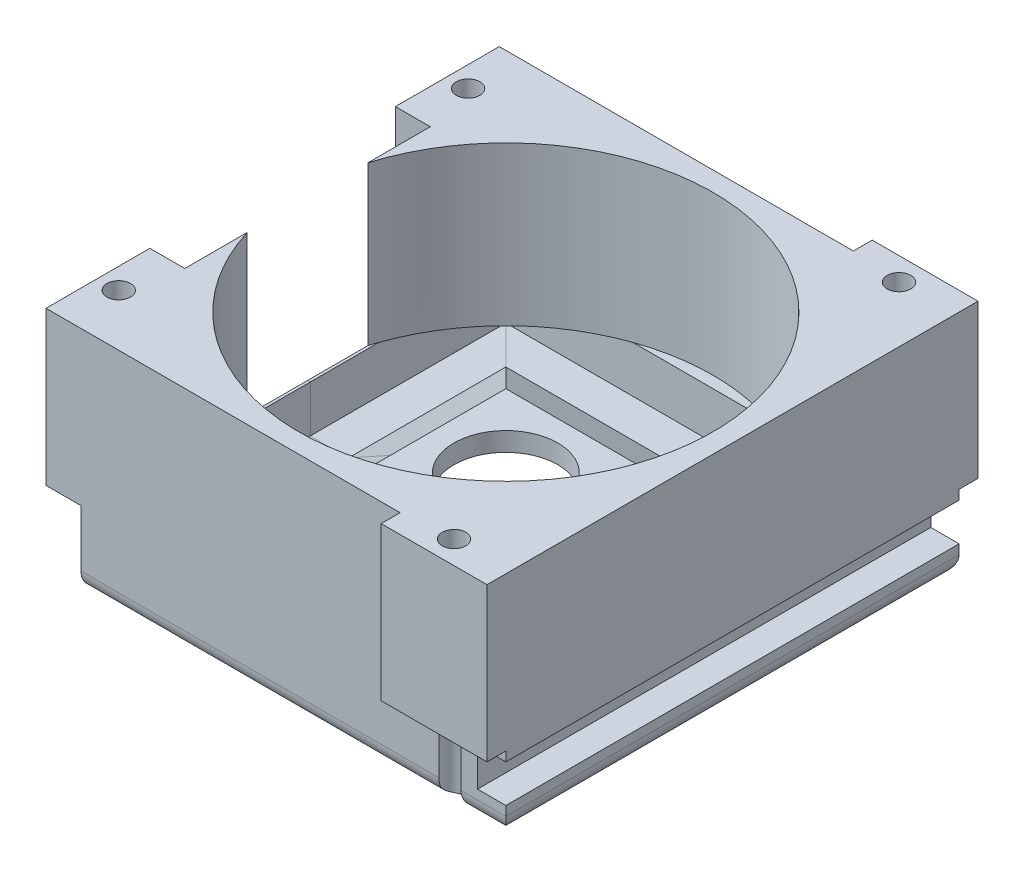
from build123d import *

# Parameters (mm, degrees)
SKETCH_8_W               = 96
SKETCH_8_H               = 96
SKETCH_8_R               = 43.9
EXTRUDE_1_DEPTH          = 33.54
CUT_EXTRUDE_3_DEPTH      = 84.429752707
CUT_EXTRUDE_3_DEPTH_BACK = 8.53
SKETCH_14_W              = 6
SKETCH_14_H              = 96
EXTRUDE_3_DEPTH          = 18.502821
EXTRUDE_3_DEPTH_BACK     = 14
SKETCH_16_W              = 22.4
SKETCH_16_H              = 4
SKETCH_16_W_2            = 7.4
SKETCH_16_H_2            = 22
SKETCH_16_R              = 2.5
FILLET_5_R               = 4
SKETCH_21_W              = 30.907014898
SKETCH_21_H              = 30.907014898
SKETCH_21_R              = 11
EXTRUDE_4_DEPTH          = 4
SKETCH_22_R              = 2.5
CUT_EXTRUDE_4_DEPTH      = 87.584546233
CUT_EXTRUDE_5_DEPTH      = 125.935517954
CUT_EXTRUDE_5_DEPTH_BACK = 125.935517954
SKETCH_23_W              = 6
SKETCH_23_H              = 8


with BuildPart() as part:
    # 掃出1: sweep along a path in 草圖6
    with BuildLine(Plane(origin=(0, 0, 0), x_dir=(1, 0, 0), z_dir=(0, 1, 0))) as sweep_1_path:
        Line((-42, 42), (42, 42))
        Line((42, 42), (42, -42))
        Line((42, -42), (-42, -42))
        Line((-42, -42), (-42, 42))
    # 草圖7 → 掃出1 (sweep)
    with BuildSketch(Plane.XY):
        with BuildLine():
            Line((-48, 0), (-48, 14.962820915))
            Line((-48, 14.962820915), (-41.427728365, 14.962820915))
            Line((-41.427728365, 14.962820915), (-41.427728365, 5.074548504))
            Line((-41.427728365, 5.074548504), (-33.350791498, 5.074548504))
            Line((-33.350791498, 5.074548504), (-15.453507449, 15))
            Line((-15.453507449, 15), (-11, 15))
            add(Edge.make_bspline(
                [(-11, 15), (-19.96241049, 7.783643124), (-30.446618789, 1.65287244), (-42, 0)],
                knots=[0, 0, 0, 0, 1, 1, 1, 1], degree=3))
            Line((-42, 0), (-48, 0))
        make_face()
    sweep(path=sweep_1_path.line, transition=Transition.RIGHT)

    # 草圖8 → 填料-伸長1 (add)
    with BuildSketch(Plane(origin=(0, 14.962820915, 0), x_dir=(1, 0, 0), z_dir=(0, 1, 0))):
        Rectangle(SKETCH_8_W, SKETCH_8_H)
        with Locations(Location((0, 0, 0), (0, 0, 70.679739301))):
            Circle(SKETCH_8_R, mode=Mode.SUBTRACT)
    extrude(amount=EXTRUDE_1_DEPTH)

    # 草圖14 → 除料-伸長3 (cut, two sides: drawn at the far end of the back side and taken through both)
    with BuildSketch(Plane(origin=(0, 0, 0), x_dir=(1, 0, 0), z_dir=(0, 1, 0)).offset(-CUT_EXTRUDE_3_DEPTH_BACK)):
        with Locations((-45, 0)):
            Rectangle(SKETCH_14_W, SKETCH_14_H)
    extrude(amount=CUT_EXTRUDE_3_DEPTH + CUT_EXTRUDE_3_DEPTH_BACK, mode=Mode.SUBTRACT)

    # 草圖16 → 填料-伸長3 (add, two sides: drawn at the far end of the back side and taken through both)
    # profile 1 of 4: a face of its own
    with BuildSketch(Plane(origin=(0, 30, 0), x_dir=(1, 0, 0), z_dir=(0, 1, 0)).offset(-EXTRUDE_3_DEPTH_BACK)):
        with Locations((36.8, 50)):
            Rectangle(SKETCH_16_W, SKETCH_16_H)
    # profile 2 of 4: a face of its own
    with BuildSketch(Plane(origin=(0, 30, 0), x_dir=(1, 0, 0), z_dir=(0, 1, 0)).offset(-EXTRUDE_3_DEPTH_BACK)):
        with Locations((36.8, -50)):
            Rectangle(SKETCH_16_W, SKETCH_16_H)
    # profile 3 of 4: a face of its own
    with BuildSketch(Plane(origin=(0, 30, 0), x_dir=(1, 0, 0), z_dir=(0, 1, 0)).offset(-EXTRUDE_3_DEPTH_BACK)):
        with Locations((-45.7, -37)):
            Rectangle(SKETCH_16_W_2, SKETCH_16_H_2)
        with Locations(Location((-45, -37, 0), (0, 0, 270))):
            Circle(SKETCH_16_R, mode=Mode.SUBTRACT)
    # profile 4 of 4: a face of its own
    with BuildSketch(Plane(origin=(0, 30, 0), x_dir=(1, 0, 0), z_dir=(0, 1, 0)).offset(-EXTRUDE_3_DEPTH_BACK)):
        with Locations((-45.7, 37)):
            Rectangle(SKETCH_16_W_2, SKETCH_16_H_2)
        with Locations(Location((-45, 37, 0), (0, 0, 270))):
            Circle(SKETCH_16_R, mode=Mode.SUBTRACT)
    extrude(amount=EXTRUDE_3_DEPTH + EXTRUDE_3_DEPTH_BACK)

    # 圓角5
    fillet_5_edges = [part.edges().sort_by_distance(p)[0] for p in [
        (3, 0, -48),
        (48, 0, 0),
        (3, 0, 48),
    ]]
    fillet(fillet_5_edges, radius=FILLET_5_R)

    # 草圖21 → 填料-伸長4 (add)
    with BuildSketch(Plane(origin=(0, 15, 0), x_dir=(1, 0, 0), z_dir=(0, 1, 0))):
        Rectangle(SKETCH_21_W, SKETCH_21_H)
        with Locations(Location((0, 0, 0), (0, 0, 270))):
            Circle(SKETCH_21_R, mode=Mode.SUBTRACT)
    extrude(amount=EXTRUDE_4_DEPTH)

    # 草圖22 → 除料-伸長4 (cut, through all)
    with BuildSketch(Plane(origin=(0, 48.502820915, 0), x_dir=(1, 0, 0), z_dir=(0, 1, 0))):
        with Locations(Location((36.142689786, 47.122458141, 0), (0, 0, 270))):
            Circle(SKETCH_22_R)
        with Locations(Location((36.142689786, -47.122458141, 0), (0, 0, 339.450483695))):
            Circle(SKETCH_22_R)
    extrude(amount=-CUT_EXTRUDE_4_DEPTH, mode=Mode.SUBTRACT)

    # 草圖23 → 除料-伸長5 (cut, two sides: drawn at the far end of the back side and taken through both)
    with BuildSketch(Plane(origin=(0, 0, -52), x_dir=(-1, 0, 0), z_dir=(0, 0, -1)).offset(-CUT_EXTRUDE_5_DEPTH_BACK)):
        with Locations((-45, 10)):
            Rectangle(SKETCH_23_W, SKETCH_23_H)
    extrude(amount=CUT_EXTRUDE_5_DEPTH + CUT_EXTRUDE_5_DEPTH_BACK, mode=Mode.SUBTRACT)


solid = part.part
